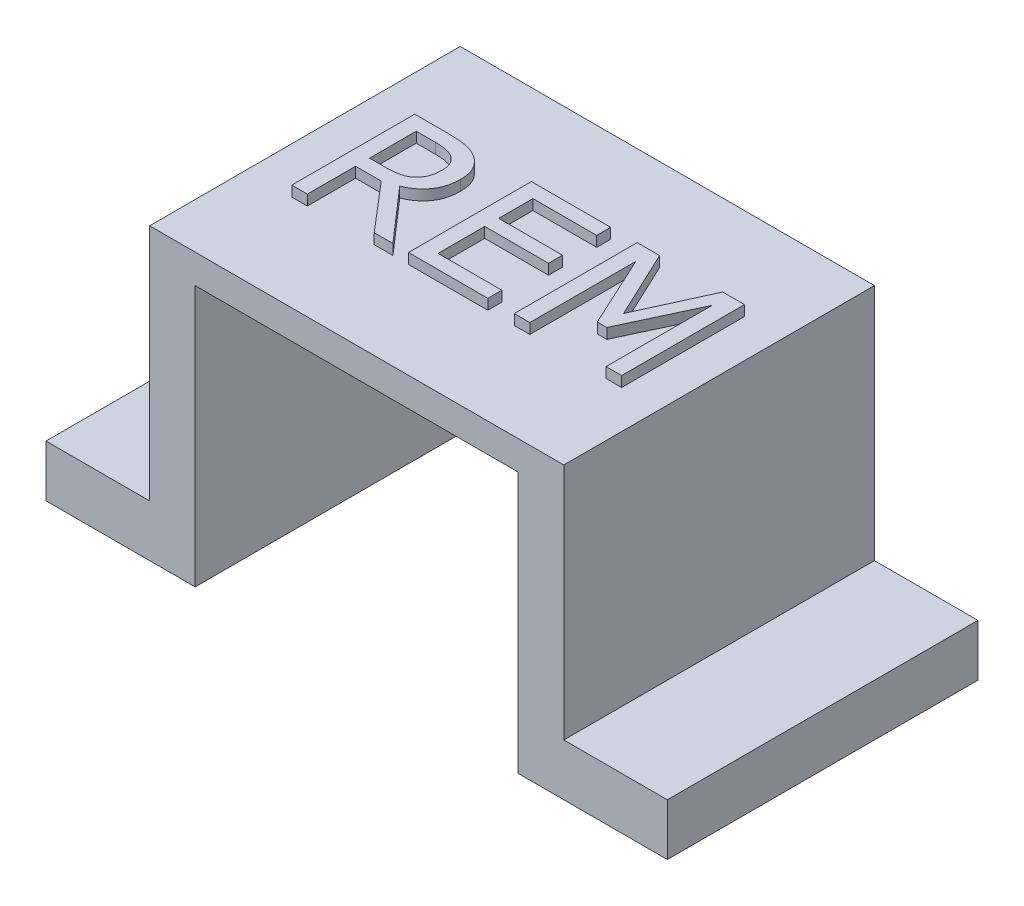
from build123d import *

# Parameters (mm, degrees)
CROQUIS1_W              = 20
CROQUIS1_H              = 14
SALIENTE_EXTRUIR1_DEPTH = 15
CROQUIS2_W              = 15.6
CROQUIS2_H              = 12.6
CORTAR_EXTRUIR1_DEPTH   = 23.825424421
CROQUIS3_W              = 15
CROQUIS3_H              = 2.5
SALIENTE_EXTRUIR2_DEPTH = 5
CROQUIS4_W              = 15
CROQUIS4_H              = 2.5
SALIENTE_EXTRUIR3_DEPTH = 5
SALIENTE_EXTRUIR4_DEPTH = 0.5


with BuildPart() as part:
    # Croquis1 → Saliente-Extruir1 (new body)
    with BuildSketch(Plane.XY):
        with Locations((0, 7)):
            Rectangle(CROQUIS1_W, CROQUIS1_H)
    extrude(amount=SALIENTE_EXTRUIR1_DEPTH)

    # Croquis2 → Cortar-Extruir1 (cut, through all)
    with BuildSketch(Plane.XY.offset(15)):
        with Locations((0, 6.3)):
            Rectangle(CROQUIS2_W, CROQUIS2_H)
    extrude(amount=-CORTAR_EXTRUIR1_DEPTH, mode=Mode.SUBTRACT)

    # Croquis3 → Saliente-Extruir2 (add)
    with BuildSketch(Plane(origin=(10, 0, 0), x_dir=(0, 0, -1), z_dir=(1, 0, 0))):
        with Locations((-7.5, 1.25)):
            Rectangle(CROQUIS3_W, CROQUIS3_H)
    extrude(amount=SALIENTE_EXTRUIR2_DEPTH)

    # Croquis4 → Saliente-Extruir3 (add)
    with BuildSketch(Plane.ZY.offset(10)):
        with Locations((7.5, 1.25)):
            Rectangle(CROQUIS4_W, CROQUIS4_H)
    extrude(amount=SALIENTE_EXTRUIR3_DEPTH)

    # Croquis5 → Saliente-Extruir4 (add)
    # profile 1 of 3: a face of its own
    with BuildSketch(Plane(origin=(0, 14, 0), x_dir=(1, 0, 0), z_dir=(0, 1, 0))):
        with BuildLine():
            Line((-2.88502332, -10.364727743), (-3.788817138, -10.364727743))
            Line((-3.788817138, -10.364727743), (-5.777163537, -8.035991464))
            Line((-5.777163537, -8.035991464), (-7.016652202, -8.035991464))
            Line((-7.016652202, -8.035991464), (-7.016652202, -10.364727743))
            Line((-7.016652202, -10.364727743), (-7.767857453, -10.364727743))
            Line((-7.767857453, -10.364727743), (-7.767857453, -4.430206259))
            Line((-7.767857453, -4.430206259), (-6.130464757, -4.430206259))
            add(Edge.make_bspline(
                [(-6.130464757, -4.430206259), (-6.0459413, -4.431165013), (-5.883831835, -4.433003829), (-5.651888426, -4.445217717), (-5.441974521, -4.467695996), (-5.251420073, -4.497198358), (-5.076320928, -4.540077128), (-4.911710387, -4.595085737), (-4.756352702, -4.665254498), (-4.659629191, -4.7231034), (-4.61162164, -4.751816007)],
                knots=[0, 0, 0, 0, 1.288415781, 2.47108201, 3.538680541, 4.505415573, 5.408010686, 6.28309489, 7.147834801, 8, 8, 8, 8], degree=3))
            add(Edge.make_bspline(
                [(-4.61162164, -4.751816007), (-4.56060529, -4.787000395), (-4.460070052, -4.856336418), (-4.326599875, -4.980440946), (-4.209578564, -5.1165849), (-4.110973827, -5.26783655), (-4.02967085, -5.435680707), (-3.976798666, -5.62564965), (-3.941292298, -5.835036609), (-3.938280358, -5.98174904), (-3.936710672, -6.058208889)],
                knots=[0, 0, 0, 0, 0.963681284, 1.899076006, 2.827943621, 3.752026167, 4.702860247, 5.71857009, 6.811022445, 8, 8, 8, 8], degree=3))
            add(Edge.make_bspline(
                [(-3.936710672, -6.058208889), (-3.93745934, -6.111069878), (-3.93892671, -6.214676048), (-3.954968911, -6.366794009), (-3.979251178, -6.512331235), (-4.01310717, -6.651852236), (-4.05794689, -6.784371061), (-4.111642187, -6.910836248), (-4.176966463, -7.029766654), (-4.250819351, -7.142352152), (-4.333124618, -7.248469966), (-4.424228497, -7.346918297), (-4.521492422, -7.440360452), (-4.627505642, -7.525742064), (-4.740372634, -7.604737188), (-4.860837683, -7.676024782), (-4.98763716, -7.742797298), (-5.076899105, -7.780006005), (-5.122206459, -7.798892307)],
                knots=[0, 0, 0, 0, 1.126128489, 2.207182719, 3.255820935, 4.268986334, 5.263032379, 6.234153775, 7.193063852, 8.150486488, 9.10116855, 10.051301984, 11.006725633, 11.972966631, 12.949086479, 13.94005042, 14.954415947, 16, 16, 16, 16], degree=3))
            Line((-5.122206459, -7.798892307), (-2.88502332, -10.364727743))
        make_face()
        with BuildLine():
            add(Edge.make_bspline(
                [(-4.763036448, -6.105159217), (-4.76425827, -6.063643734), (-4.766654107, -5.982237185), (-4.782538048, -5.863974915), (-4.811639256, -5.753311079), (-4.849434013, -5.64927727), (-4.902032931, -5.552802913), (-4.968287593, -5.463820517), (-5.050018411, -5.383249363), (-5.113312501, -5.338238747), (-5.145681623, -5.315219945)],
                knots=[0, 0, 0, 0, 1.085368415, 2.128268547, 3.1106313, 4.071895604, 5.014699805, 5.972038339, 6.962883605, 8, 8, 8, 8], degree=3))
            add(Edge.make_bspline(
                [(-5.145681623, -5.315219945), (-5.175015585, -5.296501747), (-5.234192037, -5.258740856), (-5.332300766, -5.214393463), (-5.437527778, -5.177833986), (-5.551527993, -5.151906272), (-5.67362264, -5.129845566), (-5.805927755, -5.117301749), (-5.948364796, -5.106770759), (-6.046712907, -5.10645458), (-6.097599527, -5.106290985)],
                knots=[0, 0, 0, 0, 0.843459406, 1.701540853, 2.6053125, 3.542575708, 4.535326681, 5.614234208, 6.765573065, 8, 8, 8, 8], degree=3))
            Line((-6.097599527, -5.106290985), (-7.016652202, -5.106290985))
            Line((-7.016652202, -5.106290985), (-7.016652202, -7.359906738))
            Line((-7.016652202, -7.359906738), (-6.22671293, -7.359906738))
            add(Edge.make_bspline(
                [(-6.22671293, -7.359906738), (-6.166842369, -7.358806598), (-6.050896861, -7.356676062), (-5.882983115, -7.346006667), (-5.727291264, -7.323687715), (-5.581932855, -7.297806333), (-5.447903419, -7.255709311), (-5.323535107, -7.202662948), (-5.210703341, -7.132400077), (-5.143863862, -7.075910781), (-5.110468877, -7.047687056)],
                knots=[0, 0, 0, 0, 1.210655428, 2.344558938, 3.398352313, 4.389640028, 5.325372474, 6.232137918, 7.116723723, 8, 8, 8, 8], degree=3))
            add(Edge.make_bspline(
                [(-5.110468877, -7.047687056), (-5.081919706, -7.019018524), (-5.025727055, -6.962590938), (-4.955449604, -6.866968879), (-4.894853881, -6.767164245), (-4.845837842, -6.659290565), (-4.807837038, -6.540844414), (-4.781139775, -6.408636819), (-4.766726062, -6.261588504), (-4.764301436, -6.158791145), (-4.763036448, -6.105159217)],
                knots=[0, 0, 0, 0, 0.936271895, 1.842841591, 2.741489519, 3.638077323, 4.58130199, 5.617848582, 6.75717263, 8, 8, 8, 8], degree=3))
        make_face(mode=Mode.SUBTRACT)
    # profile 2 of 3: a face of its own
    with BuildSketch(Plane(origin=(0, 14, 0), x_dir=(1, 0, 0), z_dir=(0, 1, 0))):
        Polygon((1.697328712, -10.364727743), (-2.133818069, -10.364727743), (-2.133818069, -4.430206259), (1.697328712, -4.430206259), (1.697328712, -5.106290985), (-1.382612818, -5.106290985), (-1.382612818, -6.758942537), (1.697328712, -6.758942537), (1.697328712, -7.435027264), (-1.382612818, -7.435027264), (-1.382612818, -9.688643017), (1.697328712, -9.688643017), align=None)
    # profile 3 of 3: a face of its own
    with BuildSketch(Plane(origin=(0, 14, 0), x_dir=(1, 0, 0), z_dir=(0, 1, 0))):
        Polygon((8.157693872, -10.364727743), (7.406488621, -10.364727743), (7.406488621, -5.247141969), (5.790223573, -8.712076191), (5.330110356, -8.712076191), (3.72558289, -5.247141969), (3.72558289, -10.364727743), (2.974377639, -10.364727743), (2.974377639, -4.430206259), (4.057756462, -4.430206259), (5.607117293, -7.720250507), (7.10600652, -4.430206259), (8.157693872, -4.430206259), align=None)
    extrude(amount=SALIENTE_EXTRUIR4_DEPTH)


solid = part.part
